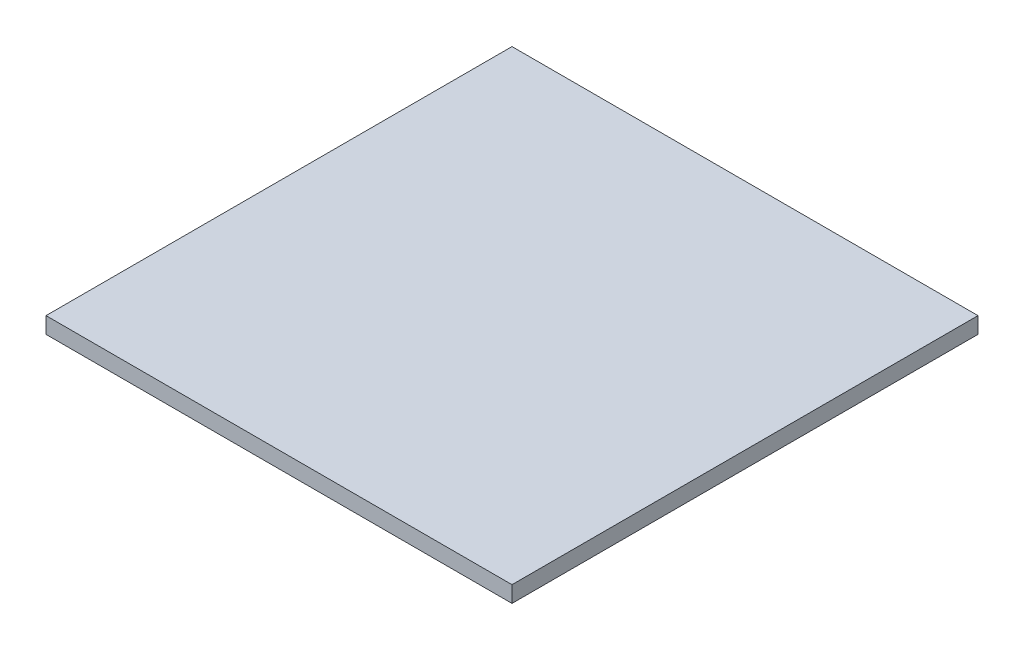
from build123d import *

# Parameters (mm, degrees)
SKETCH1_W           = 8600
SKETCH1_H           = 8600
BOSS_EXTRUDE1_DEPTH = 300


with BuildPart() as part:
    # Sketch1 → Boss-Extrude1 (new body)
    with BuildSketch(Plane(origin=(0, 0, 0), x_dir=(1, 0, 0), z_dir=(0, 1, 0))):
        Rectangle(SKETCH1_W, SKETCH1_H)
    extrude(amount=BOSS_EXTRUDE1_DEPTH)


solid = part.part
